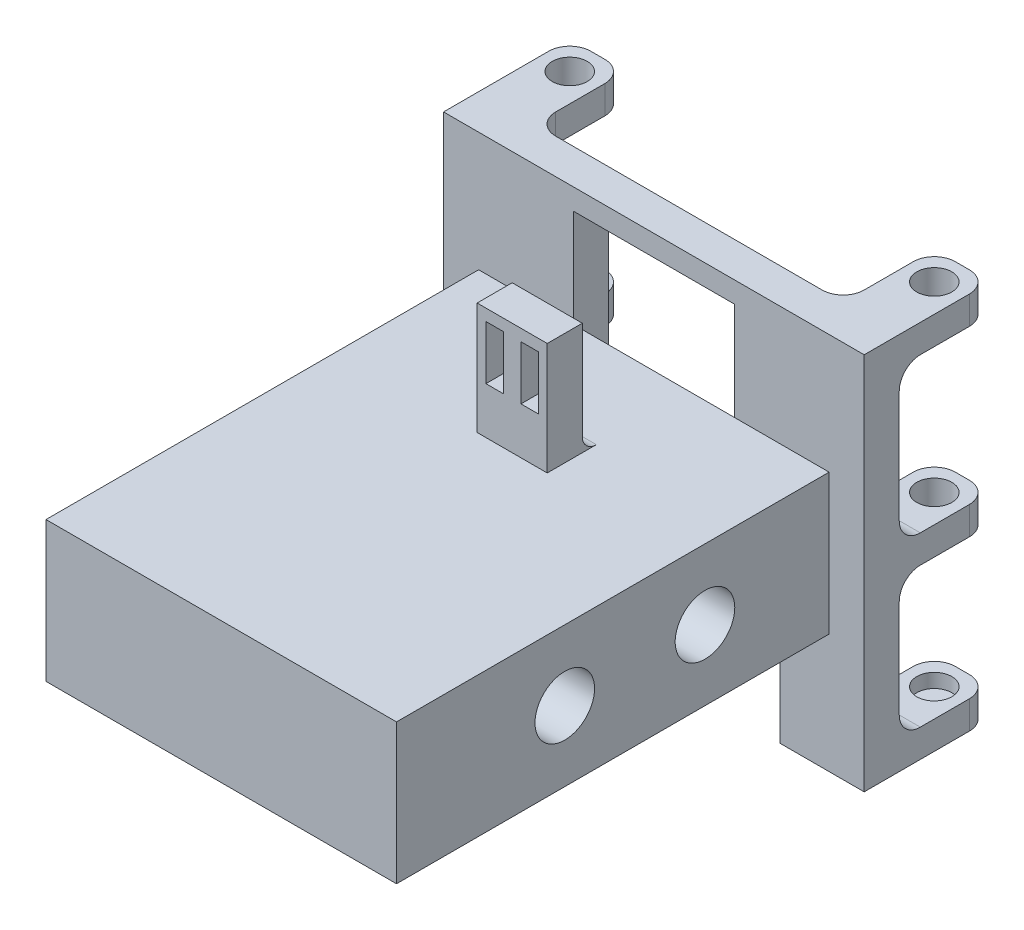
from build123d import *

# Parameters (mm, degrees)
BOSS_EXTRUDE1_DEPTH = 50
SKETCH3_R           = 4.25
CUT_EXTRUDE2_DEPTH  = 90.866567755
SKETCH5_W           = 10
SKETCH5_H           = 5
BOSS_EXTRUDE2_DEPTH = 16
FILLET1_R           = 2
SKETCH6_W           = 2.5
SKETCH6_H           = 7.68
CUT_EXTRUDE3_DEPTH  = 16
SKETCH9_W           = 50
SKETCH9_H           = 22.289567514
CUT_EXTRUDE4_DEPTH  = 92.520489509
SKETCH10_W          = 60
SKETCH10_H          = 54
BOSS_EXTRUDE3_DEPTH = 5
SKETCH11_W          = 23
SKETCH11_H          = 24
SKETCH11_W_2        = 36
CUT_EXTRUDE5_DEPTH  = 5
SKETCH12_W          = 8
SKETCH12_H          = 4
BOSS_EXTRUDE4_DEPTH = 13
FILLET2_R           = 3
FILLET3_R           = 3
FILLET4_R           = 3
FILLET5_R           = 3
SKETCH13_R          = 2.5
CUT_EXTRUDE6_DEPTH  = 13
SKETCH14_R          = 2.5
CUT_EXTRUDE7_DEPTH  = 10
SKETCH15_R          = 2.5
CUT_EXTRUDE8_DEPTH  = 2


with BuildPart() as part:
    # Sketch2 → Boss-Extrude1 (new body)
    with BuildSketch(Plane(origin=(0, 0, 0), x_dir=(0, 0, -1), z_dir=(1, 0, 0))):
        with BuildLine():
            Line((-74, 10), (0, 10))
            ThreePointArc((0, 10), (10, 0), (0, -10))
            Line((0, -10), (-74, -10))
            Line((-74, -10), (-74, 10))
        make_face()
    extrude(amount=BOSS_EXTRUDE1_DEPTH)

    # Sketch3 → Cut-Extrude2 (cut, through all)
    with BuildSketch(Plane(origin=(50, 0, 0), x_dir=(0, 0, -1), z_dir=(1, 0, 0))):
        with Locations((-30, 0)):
            Circle(SKETCH3_R)
        with Locations((-50, 0)):
            Circle(SKETCH3_R)
    extrude(amount=-CUT_EXTRUDE2_DEPTH, mode=Mode.SUBTRACT)

    # Sketch5 → Boss-Extrude2 (add)
    with BuildSketch(Plane(origin=(0, 10, 0), x_dir=(1, 0, 0), z_dir=(0, 1, 0))):
        with Locations((25, -30)):
            Rectangle(SKETCH5_W, SKETCH5_H)
    extrude(amount=BOSS_EXTRUDE2_DEPTH)

    # Fillet1
    fillet1_edges = [part.edges().sort_by_distance(p)[0] for p in [
        (25, 10, 27.5),
    ]]
    fillet(fillet1_edges, radius=FILLET1_R)

    # Sketch6 → Cut-Extrude3 (cut)
    with BuildSketch(Plane.XY.offset(32.5)):
        with Locations((22.5, 20.5)):
            Rectangle(SKETCH6_W, SKETCH6_H)
        with Locations((27.5, 20.5)):
            Rectangle(SKETCH6_W, SKETCH6_H)
    extrude(amount=-CUT_EXTRUDE3_DEPTH, mode=Mode.SUBTRACT)

    # Sketch9 → Cut-Extrude4 (cut, through all)
    with BuildSketch(Plane(origin=(0, 10, 0), x_dir=(1, 0, 0), z_dir=(0, 1, 0))):
        with Locations((25, -1.144783757)):
            Rectangle(SKETCH9_W, SKETCH9_H)
    extrude(amount=-CUT_EXTRUDE4_DEPTH, mode=Mode.SUBTRACT)

    # Sketch10 → Boss-Extrude3 (add)
    with BuildSketch(Plane(origin=(0, 0, 12.289567514), x_dir=(-1, 0, 0), z_dir=(0, 0, -1))):
        with Locations((-25, 0)):
            Rectangle(SKETCH10_W, SKETCH10_H)
    extrude(amount=BOSS_EXTRUDE3_DEPTH)

    # Sketch11 → Cut-Extrude5 (cut)
    with BuildSketch(Plane(origin=(0, 0, 7.289567514), x_dir=(-1, 0, 0), z_dir=(0, 0, -1))):
        with Locations((-25, 12)):
            Rectangle(SKETCH11_W, SKETCH11_H)
        with Locations((-25, -15)):
            Rectangle(SKETCH11_W_2, SKETCH11_H)
    extrude(amount=-CUT_EXTRUDE5_DEPTH, mode=Mode.SUBTRACT)

    # Sketch12 → Boss-Extrude4 (add)
    with BuildSketch(Plane(origin=(0, 0, 7.289567514), x_dir=(-1, 0, 0), z_dir=(0, 0, -1))):
        with Locations((1, 25)):
            Rectangle(SKETCH12_W, SKETCH12_H)
        with Locations((-51, 25)):
            Rectangle(SKETCH12_W, SKETCH12_H)
        with Locations((1, -25)):
            Rectangle(SKETCH12_W, SKETCH12_H)
        with Locations((-51, -25)):
            Rectangle(SKETCH12_W, SKETCH12_H)
        with Locations((1, -1)):
            Rectangle(SKETCH12_W, SKETCH12_H)
        with Locations((-51, -1)):
            Rectangle(SKETCH12_W, SKETCH12_H)
    extrude(amount=BOSS_EXTRUDE4_DEPTH)

    # Fillet2
    fillet2_edges = [part.edges().sort_by_distance(p)[0] for p in [
        (55, -25, -5.710432486),
        (47, -25, -5.710432486),
        (55, -1, -5.710432486),
        (47, -1, -5.710432486),
        (3, -25, -5.710432486),
        (-5, -25, -5.710432486),
        (3, -1, -5.710432486),
        (-5, -1, -5.710432486),
        (55, 25, -5.710432486),
        (47, 25, -5.710432486),
        (3, 25, -5.710432486),
        (-5, 25, -5.710432486),
    ]]
    fillet(fillet2_edges, radius=FILLET2_R)

    # Fillet3
    fillet3_edges = [part.edges().sort_by_distance(p)[0] for p in [
        (3, 25, 7.289567514),
        (-1, 23, 7.289567514),
    ]]
    fillet(fillet3_edges, radius=FILLET3_R)

    # Fillet4
    fillet4_edges = [part.edges().sort_by_distance(p)[0] for p in [
        (3, -25, 7.289567514),
        (-1, -23, 7.289567514),
        (47, -25, 7.289567514),
        (51, -23, 7.289567514),
        (47, -1, 7.289567514),
        (51, -3, 7.289567514),
        (3, -1, 7.289567514),
        (-1, -3, 7.289567514),
        (47, 25, 7.289567514),
        (51, 23, 7.289567514),
    ]]
    fillet(fillet4_edges, radius=FILLET4_R)

    # Fillet5
    fillet5_edges = [part.edges().sort_by_distance(p)[0] for p in [
        (49.5, 1, 7.289567514),
        (0.5, 1, 7.289567514),
    ]]
    fillet(fillet5_edges, radius=FILLET5_R)

    # Sketch13 → Cut-Extrude6 (cut)
    with BuildSketch(Plane(origin=(0, 27, 0), x_dir=(1, 0, 0), z_dir=(0, 1, 0))):
        with Locations((51, 1.710432486)):
            Circle(SKETCH13_R)
        with Locations((-1, 1.710432486)):
            Circle(SKETCH13_R)
    extrude(amount=-CUT_EXTRUDE6_DEPTH, mode=Mode.SUBTRACT)

    # Sketch14 → Cut-Extrude7 (cut)
    with BuildSketch(Plane(origin=(0, 1, 0), x_dir=(1, 0, 0), z_dir=(0, 1, 0))):
        with Locations((51, 1.710432486)):
            Circle(SKETCH14_R)
        with Locations((-1, 1.710432486)):
            Circle(SKETCH14_R)
    extrude(amount=-CUT_EXTRUDE7_DEPTH, mode=Mode.SUBTRACT)

    # Sketch15 → Cut-Extrude8 (cut)
    with BuildSketch(Plane(origin=(0, -23, 0), x_dir=(1, 0, 0), z_dir=(0, 1, 0))):
        with Locations((51, 1.710432486)):
            Circle(SKETCH15_R)
        with Locations((-1, 1.710432486)):
            Circle(SKETCH15_R)
    extrude(amount=-CUT_EXTRUDE8_DEPTH, mode=Mode.SUBTRACT)


solid = part.part
